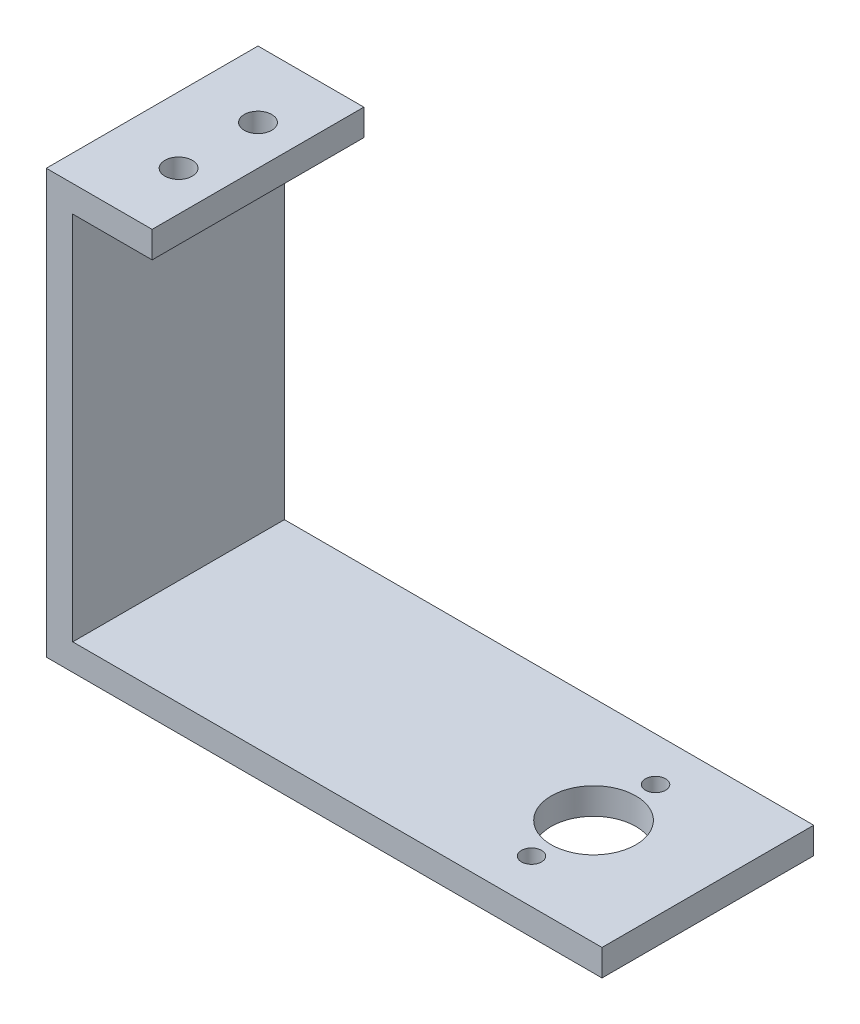
from build123d import *

# Parameters (mm, degrees)
BOSS_EXTRUDE1_DEPTH       = 25.4
M4X0_7_TAPPED_HOLE1_D     = 3.3
M4X0_7_TAPPED_HOLE1_DEPTH = 9.906
M4X0_7_TAPPED_HOLE1_TIP   = 0.991420021
CUT_EXTRUDE1_REACH        = 69.739
SKETCH7_R                 = 5.08
SKETCH7_R_2               = 1.2065


with BuildPart() as part:
    # Sketch1 → Boss-Extrude1 (new body)
    with BuildSketch(Plane.XY):
        Polygon((-17.059275079, 26.987213855), (-29.759275079, 26.987213855), (-29.759275079, -23.812786145), (36.915724921, -23.812786145), (36.915724921, -20.637786145), (-26.584275079, -20.637786145), (-26.584275079, 23.812213855), (-17.059275079, 23.812213855), align=None)
    extrude(amount=BOSS_EXTRUDE1_DEPTH)

    # M4x0.7 Tapped Hole1
    with Locations(Plane(origin=(0, 26.987213855, 0), x_dir=(1, 0, 0), z_dir=(0, 1, 0))):
        with Locations((-21.821775079, -7.9375), (-21.821775079, -17.4625)):
            Hole(M4X0_7_TAPPED_HOLE1_D / 2, depth=M4X0_7_TAPPED_HOLE1_DEPTH)
            with Locations((0, 0, -(M4X0_7_TAPPED_HOLE1_DEPTH + M4X0_7_TAPPED_HOLE1_TIP / 2))):  # 118° drill point
                Cone(0, M4X0_7_TAPPED_HOLE1_D / 2, M4X0_7_TAPPED_HOLE1_TIP, mode=Mode.SUBTRACT)

    # Sketch7 → Cut-Extrude1 (cut, up to next)
    with BuildSketch(Plane.XZ.offset(23.812786145), mode=Mode.PRIVATE) as cut_extrude1_sk1:
        with Locations(Location((23.199724921, 12.7, 0), (0, 0, 270))):
            Circle(SKETCH7_R)
    cut_extrude1_tool1 = extrude(cut_extrude1_sk1.sketch, amount=-CUT_EXTRUDE1_REACH, mode=Mode.PRIVATE) & part.part
    # Sketch7 → Cut-Extrude1 (cut, up to next)
    with BuildSketch(Plane.XZ.offset(23.812786145), mode=Mode.PRIVATE) as cut_extrude1_sk2:
        with Locations(Location((23.199724921, 5.2578, 0), (0, 0, 270))):
            Circle(SKETCH7_R_2)
    cut_extrude1_tool2 = extrude(cut_extrude1_sk2.sketch, amount=-CUT_EXTRUDE1_REACH, mode=Mode.PRIVATE) & part.part
    # Sketch7 → Cut-Extrude1 (cut, up to next)
    with BuildSketch(Plane.XZ.offset(23.812786145), mode=Mode.PRIVATE) as cut_extrude1_sk3:
        with Locations(Location((23.199724921, 20.1422, 0), (0, 0, 270))):
            Circle(SKETCH7_R_2)
    cut_extrude1_tool3 = extrude(cut_extrude1_sk3.sketch, amount=-CUT_EXTRUDE1_REACH, mode=Mode.PRIVATE) & part.part
    add(cut_extrude1_tool1.solids().sort_by_distance((23.199725, -23.812786, 12.7))[0], mode=Mode.SUBTRACT)
    add(cut_extrude1_tool2.solids().sort_by_distance((23.199725, -23.812786, 5.2578))[0], mode=Mode.SUBTRACT)
    add(cut_extrude1_tool3.solids().sort_by_distance((23.199725, -23.812786, 20.1422))[0], mode=Mode.SUBTRACT)


solid = part.part
